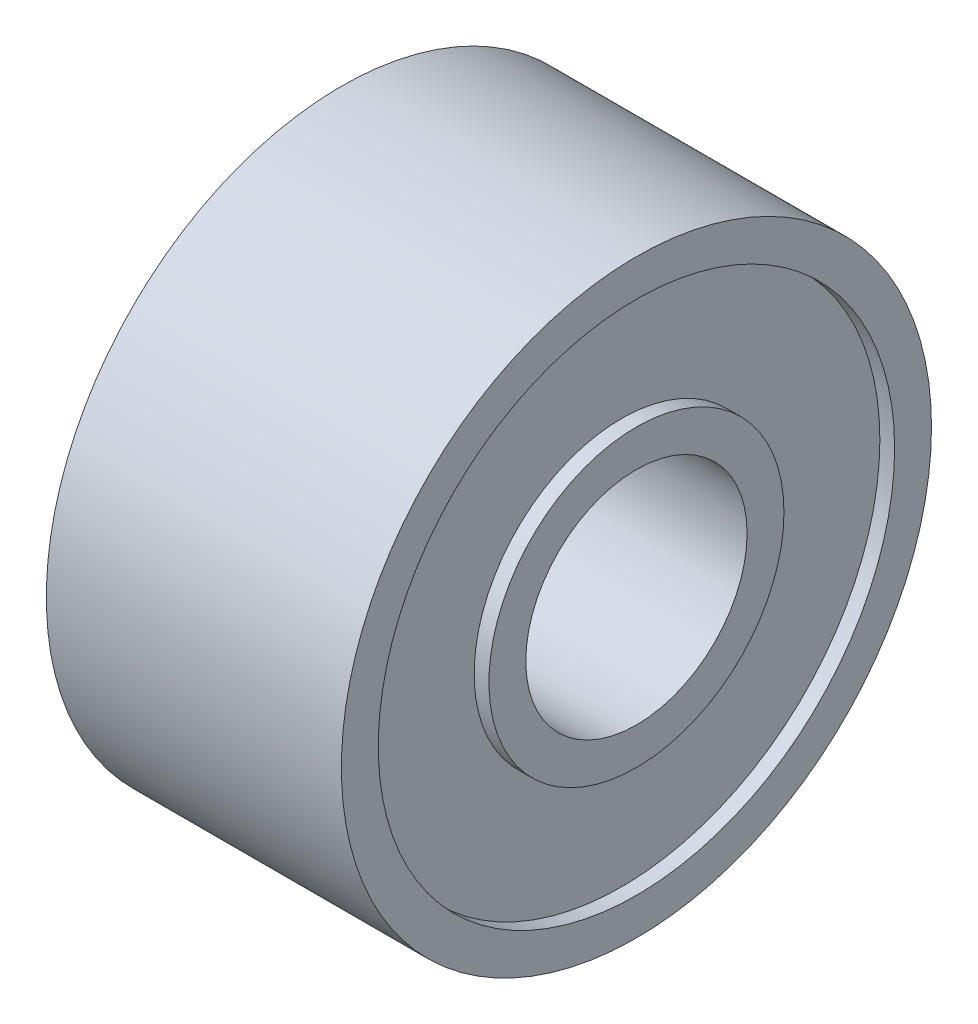
from build123d import *

# Parameters (mm, degrees)
SKETCH1_R           = 4
SKETCH1_R_2         = 1.5
BOSS_EXTRUDE1_DEPTH = 4
SKETCH2_R           = 3.5
SKETCH2_R_2         = 2
CUT_EXTRUDE1_DEPTH  = 0.2
CUT_EXTRUDE2_START  = -0.2
SKETCH3_R           = 3.5
SKETCH3_R_2         = 2
CUT_EXTRUDE2_DEPTH  = 0.2


with BuildPart() as part:
    # Sketch1 → Boss-Extrude1 (new body)
    with BuildSketch(Plane(origin=(0, 0, 0), x_dir=(0, 0, -1), z_dir=(1, 0, 0))):
        Circle(SKETCH1_R)
        Circle(SKETCH1_R_2, mode=Mode.SUBTRACT)
    extrude(amount=BOSS_EXTRUDE1_DEPTH)

    # Sketch2 → Cut-Extrude1 (cut)
    with BuildSketch(Plane(origin=(4, 0, 0), x_dir=(0, 0, -1), z_dir=(1, 0, 0))):
        Circle(SKETCH2_R)
        Circle(SKETCH2_R_2, mode=Mode.SUBTRACT)
    extrude(amount=-CUT_EXTRUDE1_DEPTH, mode=Mode.SUBTRACT)

    # Sketch3 → Cut-Extrude2 (cut)
    with BuildSketch(Plane.ZY.offset(CUT_EXTRUDE2_START)):
        with Locations(Location((0, 0, 0), (0, 0, 180))):
            Circle(SKETCH3_R)
        with Locations(Location((0, 0, 0), (0, 0, 180))):
            Circle(SKETCH3_R_2, mode=Mode.SUBTRACT)
    extrude(amount=CUT_EXTRUDE2_DEPTH, mode=Mode.SUBTRACT)


solid = part.part
